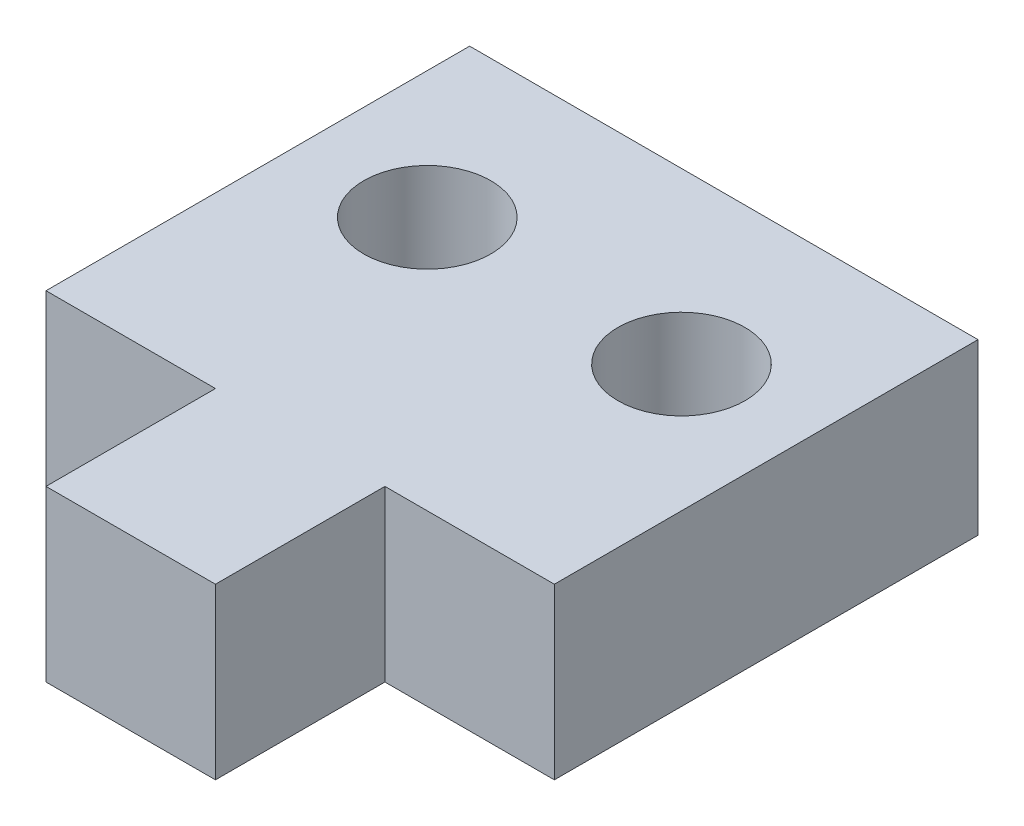
from build123d import *

# Parameters (mm, degrees)
SKETCH1_W           = 12
SKETCH1_H           = 10
SKETCH1_W_2         = 4
SKETCH1_H_2         = 4
BOSS_EXTRUDE1_DEPTH = 4
SKETCH2_R           = 1.5
CUT_EXTRUDE1_DEPTH  = 12.532562595


with BuildPart() as part:
    # Sketch1 → Boss-Extrude1 (new body)
    with BuildSketch(Plane(origin=(0, 0, 0), x_dir=(1, 0, 0), z_dir=(0, 1, 0))):
        Rectangle(SKETCH1_W, SKETCH1_H)
        with Locations((0, -7)):
            Rectangle(SKETCH1_W_2, SKETCH1_H_2)
    extrude(amount=BOSS_EXTRUDE1_DEPTH)

    # Sketch2 → Cut-Extrude1 (cut, through all)
    with BuildSketch(Plane(origin=(0, 4, 0), x_dir=(1, 0, 0), z_dir=(0, 1, 0))):
        with Locations(Location((-3, 1, 0), (0, 0, 270))):
            Circle(SKETCH2_R)
        with Locations(Location((3, 1, 0), (0, 0, 270))):
            Circle(SKETCH2_R)
    extrude(amount=-CUT_EXTRUDE1_DEPTH, mode=Mode.SUBTRACT)


solid = part.part
